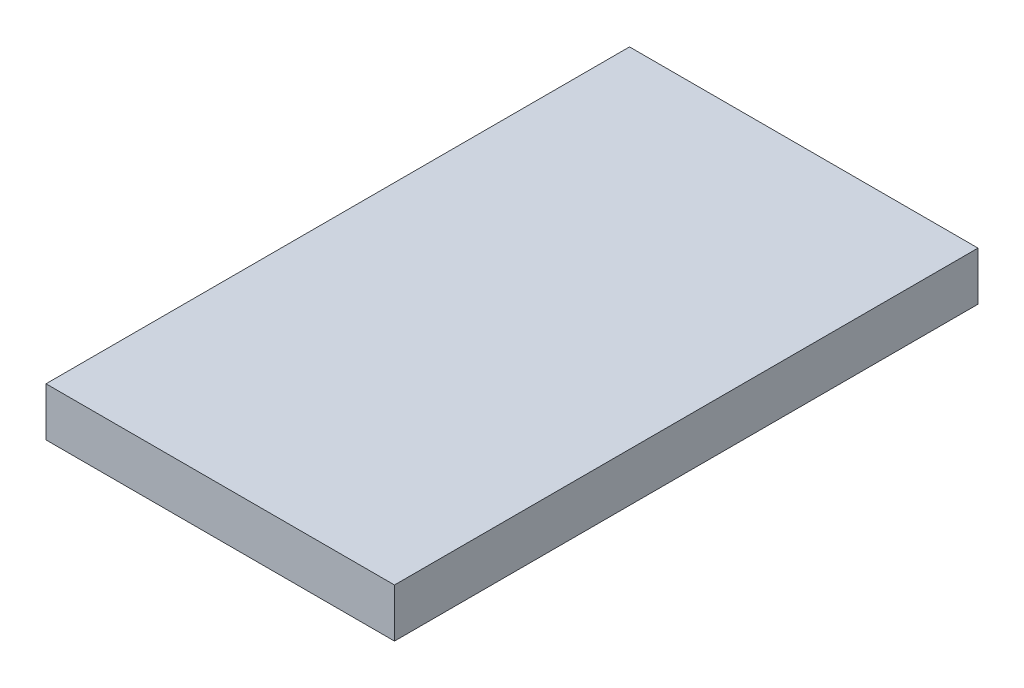
from build123d import *

# Parameters (mm, degrees)
SKETCH1_W           = 43
SKETCH1_H           = 72
BOSS_EXTRUDE1_DEPTH = 6


with BuildPart() as part:
    # Sketch1 → Boss-Extrude1 (new body)
    with BuildSketch(Plane(origin=(0, 0, 0), x_dir=(1, 0, 0), z_dir=(0, 1, 0))):
        Rectangle(SKETCH1_W, SKETCH1_H)
    extrude(amount=BOSS_EXTRUDE1_DEPTH)


solid = part.part
